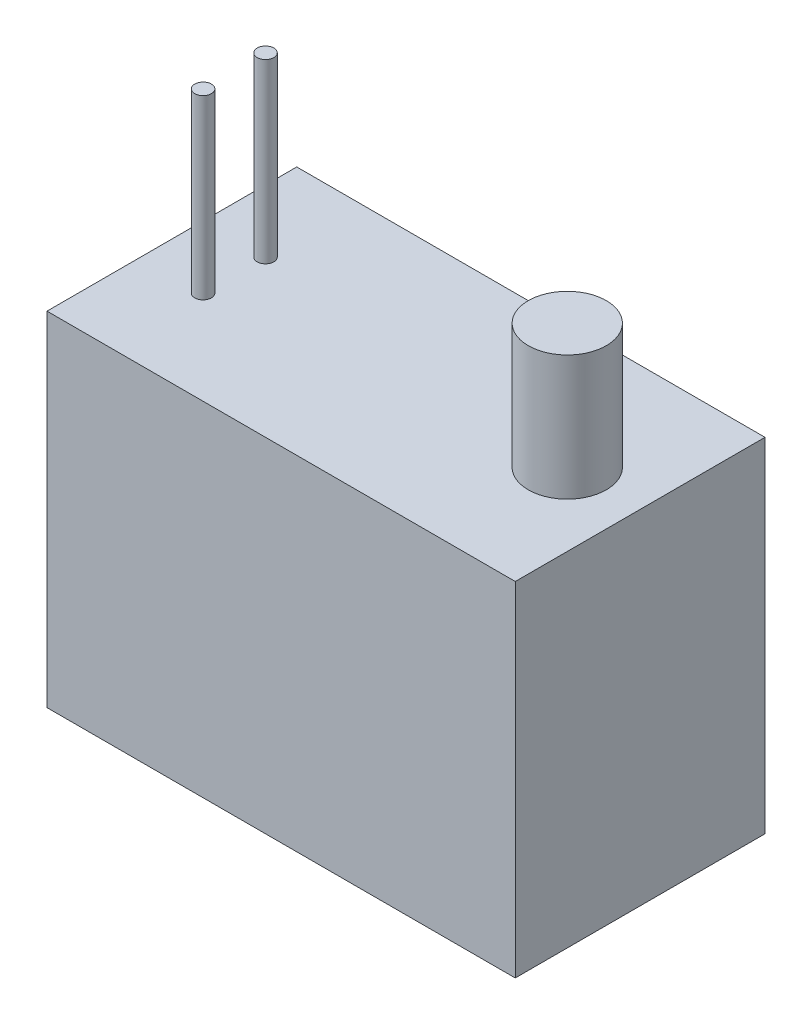
from build123d import *

# Parameters (mm, degrees)
SK_PUMP_BODY_W      = 45
SK_PUMP_BODY_H      = 24
PUMP_BODY_DEPTH     = 33
OUTLET_START        = 33
SK_OUTLET_NOZZLE_R  = 3.75
OUTLET_NOZZLE_DEPTH = 12
INLET_START         = -2
SK_INLET_R          = 4
INLET_DEPTH         = 2
LEAD_START          = 33
SK_LEAD_RED_R       = 0.8
LEAD_RED_DEPTH      = 17
SK_LEAD_BLACK_R     = 0.8
LEAD_BLACK_DEPTH    = 17


with BuildPart() as part:
    # SK Pump body → Pump body (new body)
    with BuildSketch(Plane(origin=(0, 0, 0), x_dir=(1, 0, 0), z_dir=(0, 1, 0))):
        with Locations((22.5, 12)):
            Rectangle(SK_PUMP_BODY_W, SK_PUMP_BODY_H)
    extrude(amount=PUMP_BODY_DEPTH)


with BuildPart() as body_2:
    # SK Outlet nozzle → Outlet nozzle (new body)
    with BuildSketch(Plane(origin=(0, 0, 0), x_dir=(1, 0, 0), z_dir=(0, 1, 0)).offset(OUTLET_START)):
        with Locations(Location((38, 12, 0), (0, 0, 270))):
            Circle(SK_OUTLET_NOZZLE_R)
    extrude(amount=OUTLET_NOZZLE_DEPTH)


with BuildPart() as body_3:
    # SK Inlet → Inlet (new body)
    with BuildSketch(Plane(origin=(0, 0, 0), x_dir=(0, 0, -1), z_dir=(1, 0, 0)).offset(INLET_START)):
        with Locations((12, 9)):
            Circle(SK_INLET_R)
    extrude(amount=INLET_DEPTH)


with BuildPart() as body_4:
    # SK Lead red → Lead red (new body)
    with BuildSketch(Plane(origin=(0, 0, 0), x_dir=(1, 0, 0), z_dir=(0, 1, 0)).offset(LEAD_START)):
        with Locations(Location((6, 9, 0), (0, 0, 270))):
            Circle(SK_LEAD_RED_R)
    extrude(amount=LEAD_RED_DEPTH)


with BuildPart() as body_5:
    # SK Lead black → Lead black (new body)
    with BuildSketch(Plane(origin=(0, 0, 0), x_dir=(1, 0, 0), z_dir=(0, 1, 0)).offset(LEAD_START)):
        with Locations(Location((6, 15, 0), (0, 0, 270))):
            Circle(SK_LEAD_BLACK_R)
    extrude(amount=LEAD_BLACK_DEPTH)


solid = Compound([part.part, body_2.part, body_3.part, body_4.part, body_5.part])
